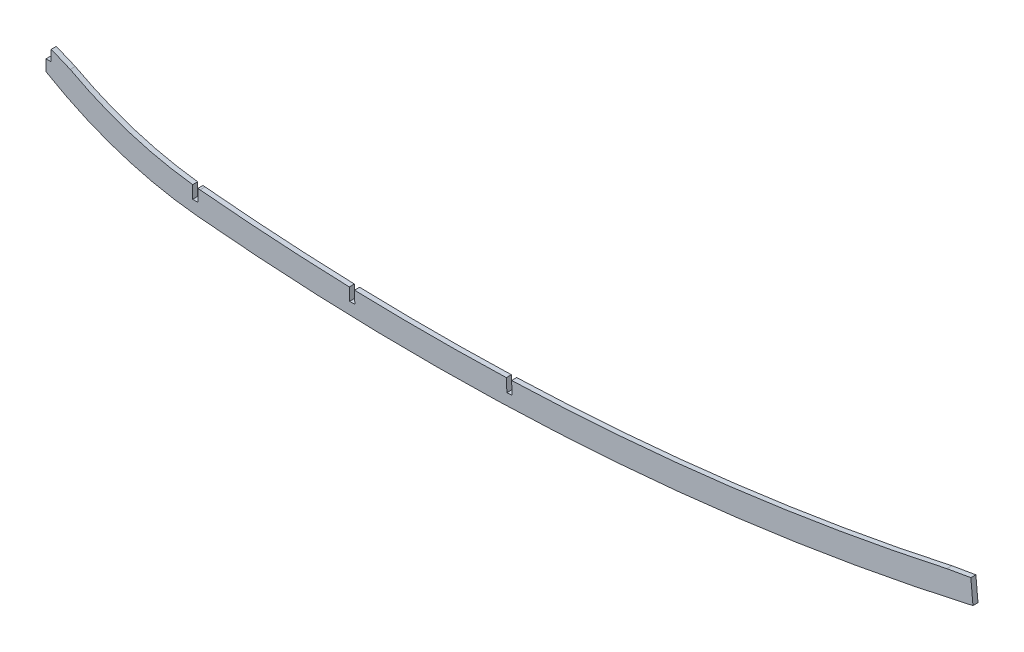
from build123d import *

# Parameters (mm, degrees)
BOSS_EXTRUDE1_DEPTH = 1.5875


with BuildPart() as part:
    # Sketch1 → Boss-Extrude1 (new, symmetric)
    with BuildSketch(Plane.XY):
        with BuildLine():
            Line((0, -90.664621669), (3.302, -90.664621669))
            Line((3.302, -90.664621669), (3.302, -83.806621669))
            Line((3.302, -83.806621669), (15.24, -88.786627106))
            ThreePointArc((15.24, -88.786627106), (52.629116117, -104.606478128), (92.329, -113.099587694))
            Line((92.329, -113.099587694), (92.329, -121.078455555))
            Line((92.329, -121.078455555), (95.631, -121.078455555))
            Line((95.631, -121.078455555), (95.631, -113.458455555))
            ThreePointArc((95.631, -113.458455555), (96.315178786, -113.526351883), (96.999571645, -113.59205528))
            ThreePointArc((96.999571645, -113.59205528), (143.916391113, -117.292313455), (190.924914267, -119.545890704))
            Line((190.924914267, -119.545890704), (191.088010164, -127.337201025))
            Line((191.088010164, -127.337201025), (194.389286946, -127.268095229))
            Line((194.389286946, -127.268095229), (194.229812033, -119.649764195))
            ThreePointArc((194.229812033, -119.649764195), (242.008318885, -120.352184929), (289.785425963, -119.560256171))
            Line((289.785425963, -119.560256171), (290.131623743, -127.604610112))
            Line((290.131623743, -127.604610112), (293.430570154, -127.462636259))
            Line((293.430570154, -127.462636259), (293.085752086, -119.450341713))
            ThreePointArc((293.085752086, -119.450341713), (430.886485092, -108.454741771), (567.129437002, -85.049543851))
            Line((567.129437002, -85.049543851), (582.192517176, -82.415688618))
            Line((582.192517176, -82.415688618), (583.522459193, -97.003520311))
            ThreePointArc((583.522459193, -97.003520311), (340.810991625, -132.334178874), (95.5675, -128.764621669))
            ThreePointArc((95.5675, -128.764621669), (46.062902856, -118.505679901), (0, -97.669173356))
            Line((0, -97.669173356), (0, -90.664621669))
        make_face()
    extrude(amount=BOSS_EXTRUDE1_DEPTH, both=True)


solid = part.part
